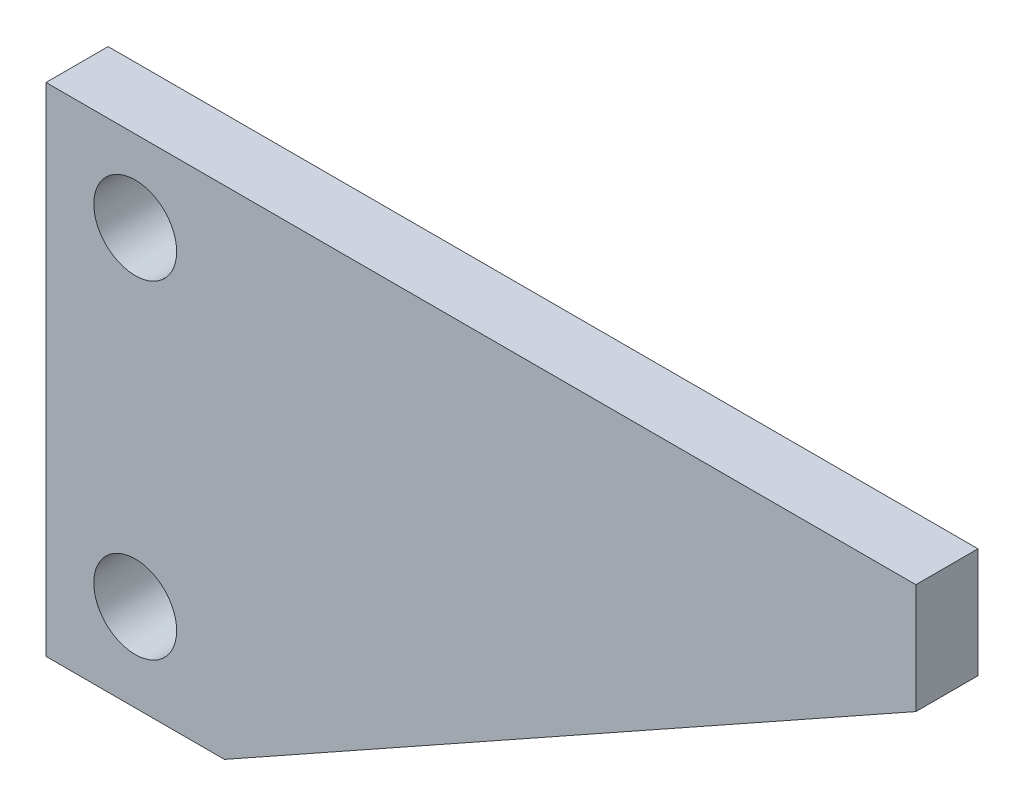
from build123d import *

# Parameters (mm, degrees)
SKETCH1_R           = 8.466666667
BOSS_EXTRUDE1_DEPTH = 12.7


with BuildPart() as part:
    # Sketch1 → Boss-Extrude1 (new body)
    with BuildSketch(Plane.XY):
        Polygon((-65.453846154, 40.053846154), (-65.453846154, -61.546153846), (-28.982051282, -61.546153846), (112.346153846, 17.584615385), (112.346153846, 40.053846154), align=None)
        with Locations((-47.217948718, 23.446153846)):
            Circle(SKETCH1_R, mode=Mode.SUBTRACT)
        with Locations((-47.217948718, -43.635897436)):
            Circle(SKETCH1_R, mode=Mode.SUBTRACT)
    extrude(amount=BOSS_EXTRUDE1_DEPTH)


solid = part.part
